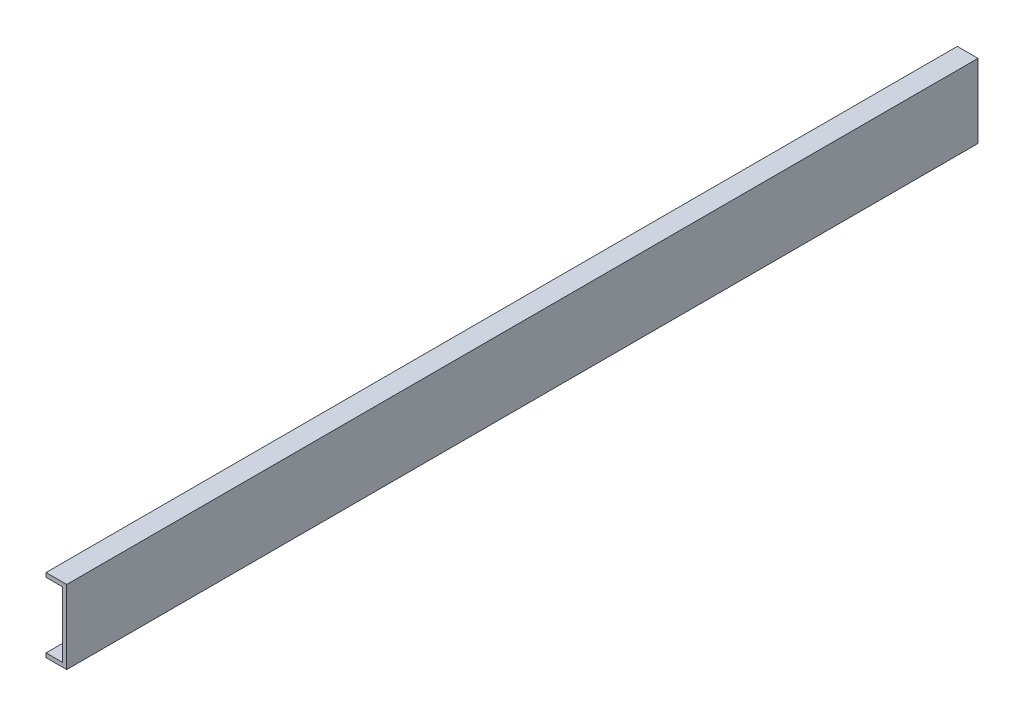
from build123d import *

# Parameters (mm, degrees)
SKETCH1_W           = 12.7
SKETCH1_H           = 45.212
BOSS_EXTRUDE1_DEPTH = 558.8
SKETCH2_W           = 10.16
SKETCH2_H           = 40.132
CUT_EXTRUDE1_DEPTH  = 560.293119693


with BuildPart() as part:
    # Sketch1 → Boss-Extrude1 (new body)
    with BuildSketch(Plane.XY):
        Rectangle(SKETCH1_W, SKETCH1_H)
    extrude(amount=BOSS_EXTRUDE1_DEPTH)

    # Sketch2 → Cut-Extrude1 (cut, through all)
    with BuildSketch(Plane.XY.offset(558.8)):
        with Locations((-1.27, 0)):
            Rectangle(SKETCH2_W, SKETCH2_H)
    extrude(amount=-CUT_EXTRUDE1_DEPTH, mode=Mode.SUBTRACT)


solid = part.part
